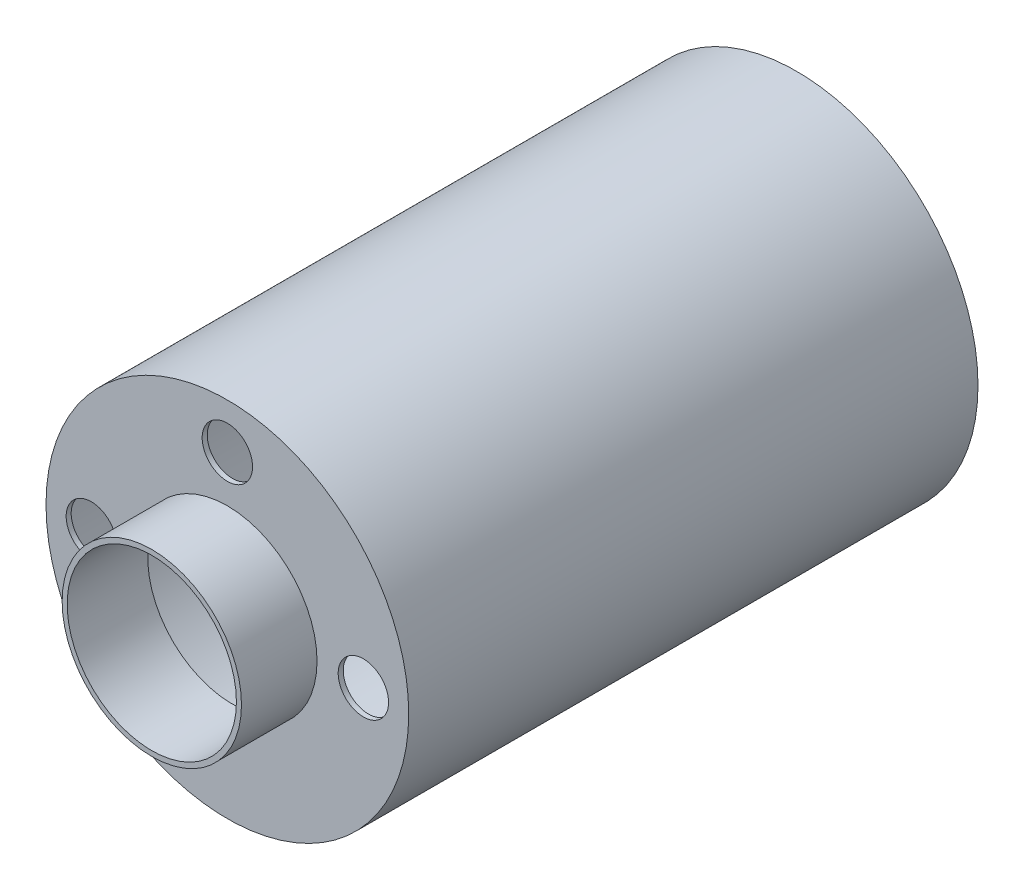
from build123d import *

# Parameters (mm, degrees)
SKETCH1_R           = 18
BOSS_EXTRUDE1_DEPTH = 28.25
SKETCH2_R           = 8.9
BOSS_EXTRUDE2_DEPTH = 7.5
SHELL1_T            = -0.5
SKETCH4_R           = 2.5
CUT_EXTRUDE1_DEPTH  = 7.5


with BuildPart() as part:
    # Sketch1 → Boss-Extrude1 (new, symmetric)
    with BuildSketch(Plane.XY):
        Circle(SKETCH1_R)
    extrude(amount=BOSS_EXTRUDE1_DEPTH, both=True)

    # Sketch2 → Boss-Extrude2 (add)
    with BuildSketch(Plane.XY.offset(28.25)):
        Circle(SKETCH2_R)
    extrude(amount=BOSS_EXTRUDE2_DEPTH)

    # Shell1
    shell1_openings = [part.faces().sort_by_distance(p)[0] for p in [
        (0, 0, -28.25),
        (0, 0, 35.75),
    ]]
    offset(amount=SHELL1_T, openings=shell1_openings, kind=Kind.INTERSECTION)

    # Sketch4 → Cut-Extrude1 (cut)
    with BuildSketch(Plane.XY.offset(28.25)):
        with Locations((-13.5, 0)):
            Circle(SKETCH4_R)
        with Locations((0, 13.5)):
            Circle(SKETCH4_R)
        with Locations((13.5, 0)):
            Circle(SKETCH4_R)
    extrude(amount=-CUT_EXTRUDE1_DEPTH, mode=Mode.SUBTRACT)


solid = part.part
